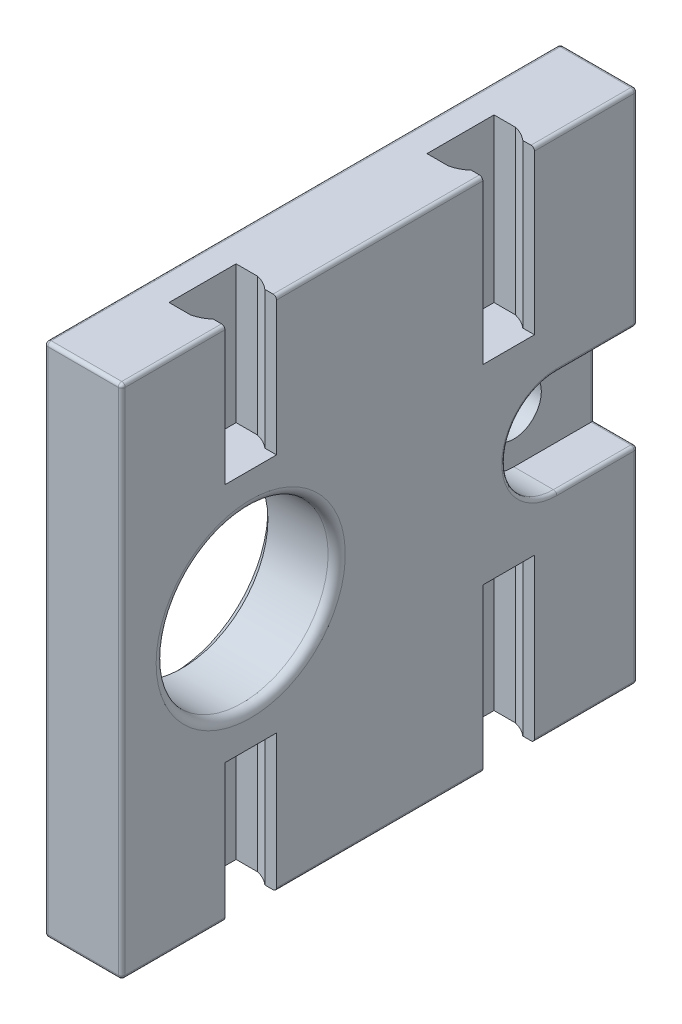
from build123d import *

# Parameters (mm, degrees)
SKETCH_1_W          = 30
SKETCH_1_H          = 30
EXTRUDE_1_DEPTH     = 4.5
SKETCH_2_R          = 5
SKETCH_2_R_2        = 1.6
CUT_EXTRUDE_1_DEPTH = 22.685248442
CUT_EXTRUDE_2_DEPTH = 2.5
CUT_EXTRUDE_3_DEPTH = 8
CUT_EXTRUDE_4_DEPTH = 9.45
CUT_EXTRUDE_5_DEPTH = 2.5
FILLET_1_R          = 0.2
FILLET_2_R          = 0.2
CHAMFER_1_SIZE      = 0.5
FILLET_3_R          = 0.5


with BuildPart() as part:
    # 草图1 → 凸台-拉伸1 (new body)
    with BuildSketch(Plane(origin=(0, 0, 0), x_dir=(0, 0, -1), z_dir=(1, 0, 0))):
        Rectangle(SKETCH_1_W, SKETCH_1_H)
    extrude(amount=EXTRUDE_1_DEPTH)

    # 草图2 → 切除-拉伸1 (cut, through all)
    with BuildSketch(Plane(origin=(4.5, 0, 0), x_dir=(0, 0, -1), z_dir=(1, 0, 0))):
        with Locations((-7.5, 0)):
            Circle(SKETCH_2_R)
        with Locations((10.3, 0)):
            Circle(SKETCH_2_R_2)
    extrude(amount=-CUT_EXTRUDE_1_DEPTH, mode=Mode.SUBTRACT)

    # 草图3 → 切除-拉伸2 (cut)
    with BuildSketch(Plane(origin=(4.5, 0, 0), x_dir=(0, 0, -1), z_dir=(1, 0, 0))):
        with BuildLine():
            Line((10.3, 3), (15, 3))
            Line((15, 3), (15, -3))
            Line((15, -3), (10.3, -3))
            ThreePointArc((10.3, -3), (7.3, 0), (10.3, 3))
        make_face()
    extrude(amount=-CUT_EXTRUDE_2_DEPTH, mode=Mode.SUBTRACT)

    # 草图4 → 切除-拉伸3 (cut)
    with BuildSketch(Plane.XZ.offset(15)):
        with BuildLine():
            Line((1.7, 5.55), (1.7, 9.45))
            Line((1.7, 9.45), (2.944409721, 9.45))
            ThreePointArc((2.944409721, 9.45), (3.411838473, 9.280042303), (3.822875656, 9))
            Line((3.822875656, 9), (4.5, 9))
            Line((4.5, 9), (4.5, 6))
            Line((4.5, 6), (3.822875656, 6))
            ThreePointArc((3.822875656, 6), (3.411838473, 5.719957697), (2.944409721, 5.55))
            Line((2.944409721, 5.55), (1.7, 5.55))
        make_face()
    cut_extrude_3 = extrude(amount=-CUT_EXTRUDE_3_DEPTH, mode=Mode.SUBTRACT)

    # 镜向1: 切除-拉伸3 across plane
    add(cut_extrude_3.mirror(Plane.ZX), mode=Mode.SUBTRACT)

    # 草图5 → 切除-拉伸4 (cut)
    with BuildSketch(Plane.XZ.offset(15)):
        with BuildLine():
            Line((1.7, -9.45), (1.7, -5.55))
            Line((1.7, -5.55), (2.944409721, -5.55))
            ThreePointArc((2.944409721, -5.55), (3.411838473, -5.719957697), (3.822875656, -6))
            Line((3.822875656, -6), (4.5, -6))
            Line((4.5, -6), (4.5, -9))
            Line((4.5, -9), (3.822875656, -9))
            ThreePointArc((3.822875656, -9), (3.411838473, -9.280042303), (2.944409721, -9.45))
            Line((2.944409721, -9.45), (1.7, -9.45))
        make_face()
    cut_extrude_4 = extrude(amount=-CUT_EXTRUDE_4_DEPTH, mode=Mode.SUBTRACT)

    # 镜向2: 切除-拉伸4 across plane
    add(cut_extrude_4.mirror(Plane.ZX), mode=Mode.SUBTRACT)

    # 草图6 → 切除-拉伸5 (cut)
    with BuildSketch(Plane.ZY):
        with BuildLine():
            Line((-3.5, 13), (3.5, 13))
            Line((3.5, 13), (3.5, 5.744562647))
            ThreePointArc((3.5, 5.744562647), (0.5, 0), (3.5, -5.744562647))
            Line((3.5, -5.744562647), (3.5, -13))
            Line((3.5, -13), (-3.5, -13))
            Line((-3.5, -13), (-3.5, -3.5))
            Line((-3.5, -3.5), (-7, -3.5))
            Line((-7, -3.5), (-7, 3.5))
            Line((-7, 3.5), (-3.5, 3.5))
            Line((-3.5, 3.5), (-3.5, 13))
        make_face()
    extrude(amount=-CUT_EXTRUDE_5_DEPTH, mode=Mode.SUBTRACT)

    # 圆角1
    fillet_1_edges = [part.edges().sort_by_distance(p)[0] for p in [
        (4.5, 0, 15),
        (4.5, 15, 0),
        (4.5, -15, 12),
        (4.5, 9, -15),
        (4.5, 0, -7.3),
        (4.5, -3, -12.65),
        (4.5, 3, -12.65),
        (2, 0, -15),
        (3.25, 3, -15),
        (3.25, -3, -15),
        (4.5, -15, 0),
        (4.5, -9, -15),
        (0, -15, 0),
        (0, 0, 15),
        (0, 15, 0),
        (0, 0, -15),
        (4.5, 15, 12),
        (4.5, 15, -12),
        (2.25, -15, -15),
        (2.25, -15, 15),
        (2.25, 15, 15),
        (2.25, 15, -15),
        (4.5, -15, -12),
    ]]
    fillet(fillet_1_edges, radius=FILLET_1_R)

    # 圆角2
    fillet_2_edges = [part.edges().sort_by_distance(p)[0] for p in [
        (0, 8.25, -3.5),
        (0, 3.5, -5.25),
        (0, 0, -7),
        (0, -3.5, -5.25),
        (0, -8.25, -3.5),
        (0, -13, 0),
        (0, -9.372281323, 3.5),
        (0, 0, 0.5),
        (0, 9.372281323, 3.5),
        (0, 13, 0),
    ]]
    fillet(fillet_2_edges, radius=FILLET_2_R)

    # 倒角1
    chamfer_1_edges = [part.edges().sort_by_distance(p)[0] for p in [
        (0, 0, 12.5),
    ]]
    chamfer(chamfer_1_edges, length=CHAMFER_1_SIZE)

    # 圆角3
    fillet_3_edges = [part.edges().sort_by_distance(p)[0] for p in [
        (4.5, 0, 12.5),
    ]]
    fillet(fillet_3_edges, radius=FILLET_3_R)


solid = part.part
